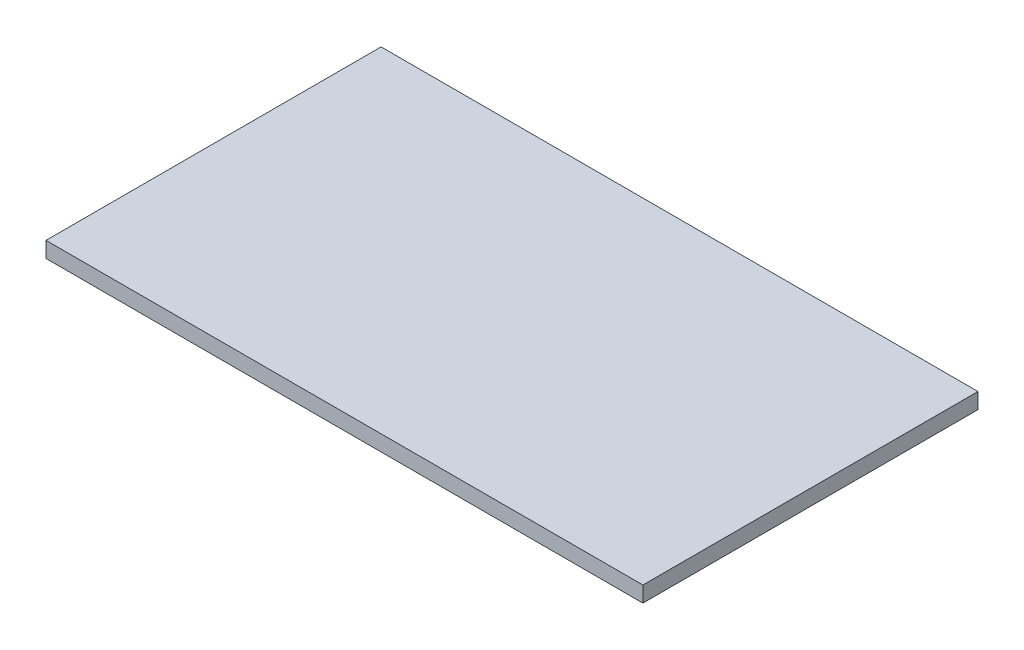
from build123d import *

# Parameters (mm, degrees)
SKETCH1_W           = 57
SKETCH1_H           = 32
BOSS_EXTRUDE1_DEPTH = 1.5


with BuildPart() as part:
    # Sketch1 → Boss-Extrude1 (new body)
    with BuildSketch(Plane(origin=(0, 0, 0), x_dir=(1, 0, 0), z_dir=(0, 1, 0))):
        Rectangle(SKETCH1_W, SKETCH1_H)
    extrude(amount=BOSS_EXTRUDE1_DEPTH)


solid = part.part
